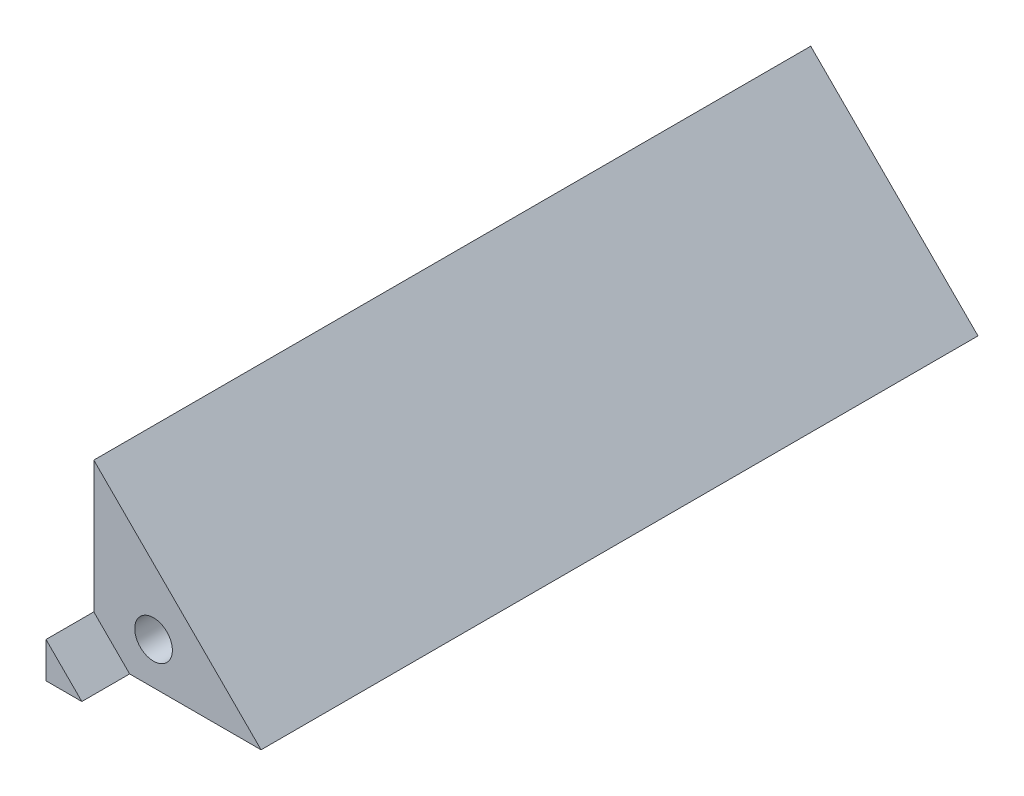
from build123d import *

# Parameters (mm, degrees)
RESSALTO_EXTRUS_O1_DEPTH                    = 60
RESSALTO_EXTRUS_O2_DEPTH                    = 4
RESSALTO_EXTRUS_O3_DEPTH                    = 4
FURO_ROSCADO_PARA_CONDU_TE_DE_M3X0_51_D     = 3.15
FURO_ROSCADO_PARA_CONDU_TE_DE_M3X0_51_DEPTH = 10
FURO_ROSCADO_PARA_CONDU_TE_DE_M3X0_51_TIP   = 0.946355475
FURO_ROSCADO_PARA_CONDU_TE_DE_M3X0_52_D     = 3.15
FURO_ROSCADO_PARA_CONDU_TE_DE_M3X0_52_DEPTH = 7.5
FURO_ROSCADO_PARA_CONDU_TE_DE_M3X0_52_TIP   = 0.946355475


with BuildPart() as part:
    # Esboço1 → Ressalto-extrusão1 (new body)
    with BuildSketch(Plane.XY):
        Polygon((0, 0), (14, 0), (0, 14), align=None)
    extrude(amount=RESSALTO_EXTRUS_O1_DEPTH)

    # Esboço2 → Ressalto-extrusão2 (add)
    with BuildSketch(Plane.XY.offset(60)):
        Polygon((0, 0), (0, 3), (3, 0), align=None)
    extrude(amount=RESSALTO_EXTRUS_O2_DEPTH)

    # Esboço3 → Ressalto-extrusão3 (add)
    with BuildSketch(Plane(origin=(0, 0, 0), x_dir=(-1, 0, 0), z_dir=(0, 0, -1))):
        Polygon((0, 0), (0, 3), (-3, 0), align=None)
    extrude(amount=RESSALTO_EXTRUS_O3_DEPTH)

    # Furo roscado para conduíte de M3x0.51
    with Locations(Plane.XY.offset(60)):
        with Locations((5, 3.5)):
            Hole(FURO_ROSCADO_PARA_CONDU_TE_DE_M3X0_51_D / 2, depth=FURO_ROSCADO_PARA_CONDU_TE_DE_M3X0_51_DEPTH)
            with Locations((0, 0, -(FURO_ROSCADO_PARA_CONDU_TE_DE_M3X0_51_DEPTH + FURO_ROSCADO_PARA_CONDU_TE_DE_M3X0_51_TIP / 2))):  # 118° drill point
                Cone(0, FURO_ROSCADO_PARA_CONDU_TE_DE_M3X0_51_D / 2, FURO_ROSCADO_PARA_CONDU_TE_DE_M3X0_51_TIP, mode=Mode.SUBTRACT)

    # Furo roscado para conduíte de M3x0.52
    with Locations(Plane(origin=(0, 0, 0), x_dir=(-1, 0, 0), z_dir=(0, 0, -1))):
        with Locations((-5, 3.5)):
            Hole(FURO_ROSCADO_PARA_CONDU_TE_DE_M3X0_52_D / 2, depth=FURO_ROSCADO_PARA_CONDU_TE_DE_M3X0_52_DEPTH)
            with Locations((0, 0, -(FURO_ROSCADO_PARA_CONDU_TE_DE_M3X0_52_DEPTH + FURO_ROSCADO_PARA_CONDU_TE_DE_M3X0_52_TIP / 2))):  # 118° drill point
                Cone(0, FURO_ROSCADO_PARA_CONDU_TE_DE_M3X0_52_D / 2, FURO_ROSCADO_PARA_CONDU_TE_DE_M3X0_52_TIP, mode=Mode.SUBTRACT)


solid = part.part
